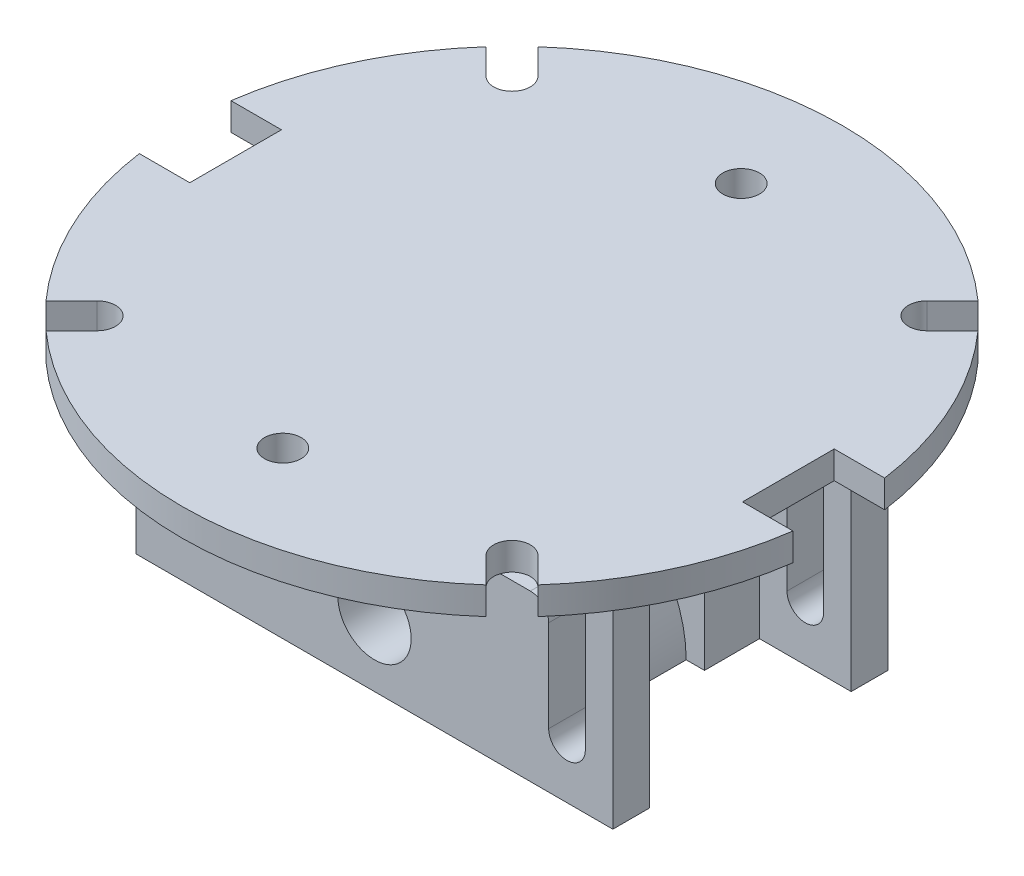
from build123d import *

# Parameters (mm, degrees)
EXTRUDE_1_DEPTH           = 12.5
CUT_EXTRUDE_1_DEPTH       = 20.532024985
CUT_EXTRUDE_1_DEPTH_BACK  = 20.532024985
SKETCH_2_R                = 2
CUT_EXTRUDE_2_DEPTH       = 20.532024985
CUT_EXTRUDE_2_DEPTH_BACK  = 20.532024985
CUT_EXTRUDE_START         = 12.5
SKETCH_5_W                = 16
SKETCH_5_H                = 5
CUT_EXTRUDE_4_DEPTH       = 5.5
CUT_EXTRUDE_5_DEPTH       = 2.5
CUT_EXTRUDE_5_DEPTH_BACK  = 2.5
EXTRUDE_START             = 12.5
EXTRUDE_5_DEPTH           = 1.5
SKETCH_8_R                = 1
CUT_EXTRUDE_6_DEPTH       = 1.5
CUT_EXTRUDE_START_2       = 14
CUT_EXTRUDE_7_DEPTH       = 1.5
CUT_EXTRUDE_9_DEPTH       = 29.943911277
CUT_EXTRUDE_9_DEPTH_BACK  = 29.943911277
CUT_EXTRUDE_10_DEPTH      = 29.943911277
CUT_EXTRUDE_10_DEPTH_BACK = 29.943911277


with BuildPart() as part:
    # 草图1 → 凸台-拉伸1 (new body)
    with BuildSketch(Plane(origin=(0, 0, 0), x_dir=(1, 0, 0), z_dir=(0, 1, 0))):
        Polygon((13, 5.5), (8, 5.5), (8, -5.5), (13, -5.5), (13, -7.5), (-13, -7.5), (-13, -5.5), (-8, -5.5), (-8, 5.5), (-13, 5.5), (-13, 7.5), (13, 7.5), align=None)
    extrude(amount=EXTRUDE_1_DEPTH)

    # 草图2 → 切除-拉伸1 (cut, two sides: drawn at the far end of the back side and taken through both)
    with BuildSketch(Plane.XY.offset(-CUT_EXTRUDE_1_DEPTH_BACK)):
        with Locations((0, 3.5)):
            Circle(SKETCH_2_R)
    extrude(amount=CUT_EXTRUDE_1_DEPTH + CUT_EXTRUDE_1_DEPTH_BACK, mode=Mode.SUBTRACT)

    # 草图3 → 切除-拉伸2 (cut, two sides: drawn at the far end of the back side and taken through both)
    with BuildSketch(Plane.XY.offset(-CUT_EXTRUDE_2_DEPTH_BACK)):
        with BuildLine():
            Line((-10.5, 11), (-2, 11))
            ThreePointArc((-2, 11), (-1, 10), (-2, 9))
            Line((-2, 9), (-10.5, 9))
            ThreePointArc((-10.5, 9), (-11.5, 10), (-10.5, 11))
        make_face()
        with BuildLine():
            Line((2, 9), (10.5, 9))
            ThreePointArc((10.5, 9), (11.5, 10), (10.5, 11))
            Line((10.5, 11), (2, 11))
            ThreePointArc((2, 11), (1, 10), (2, 9))
        make_face()
    extrude(amount=CUT_EXTRUDE_2_DEPTH + CUT_EXTRUDE_2_DEPTH_BACK, mode=Mode.SUBTRACT)

    # 草图5 → 切除-拉伸4 (cut)
    with BuildSketch(Plane(origin=(0, 0, 0), x_dir=(1, 0, 0), z_dir=(0, 1, 0)).offset(CUT_EXTRUDE_START)):
        Rectangle(SKETCH_5_W, SKETCH_5_H)
    extrude(amount=-CUT_EXTRUDE_4_DEPTH, mode=Mode.SUBTRACT)

    # 草图6 → 切除-拉伸5 (cut, two sides: drawn at the far end of the back side and taken through both)
    with BuildSketch(Plane.XY.offset(-CUT_EXTRUDE_5_DEPTH_BACK)):
        with BuildLine():
            Line((8, 7), (0, 7))
            ThreePointArc((0, 7), (4.949747468, 4.949747468), (7, 0))
            Line((7, 0), (8, 0))
            Line((8, 0), (8, 7))
        make_face()
        with BuildLine():
            Line((-8, 7), (-8, 0))
            Line((-8, 0), (-7, 0))
            ThreePointArc((-7, 0), (-4.949747468, 4.949747468), (0, 7))
            Line((0, 7), (-8, 7))
        make_face()
    extrude(amount=CUT_EXTRUDE_5_DEPTH + CUT_EXTRUDE_5_DEPTH_BACK, mode=Mode.SUBTRACT)

    # 草图7 → 凸台-拉伸5 (add)
    with BuildSketch(Plane(origin=(0, 0, 0), x_dir=(1, 0, 0), z_dir=(0, 1, 0)).offset(EXTRUDE_START)):
        with BuildLine():
            Line((17.82554347, 2.5), (15.07554347, 2.5))
            Line((15.07554347, 2.5), (15.07554347, -2.5))
            Line((15.07554347, -2.5), (17.82554347, -2.5))
            ThreePointArc((17.82554347, -2.5), (0, -18), (-17.82554347, -2.5))
            Line((-17.82554347, -2.5), (-15.07554347, -2.5))
            Line((-15.07554347, -2.5), (-15.07554347, 2.5))
            Line((-15.07554347, 2.5), (-17.82554347, 2.5))
            ThreePointArc((-17.82554347, 2.5), (0, 18), (17.82554347, 2.5))
        make_face()
    extrude(amount=EXTRUDE_5_DEPTH)

    # 草图8 → 切除-拉伸6 (cut)
    with BuildSketch(Plane(origin=(0, 0, 0), x_dir=(1, 0, 0), z_dir=(0, 1, 0)).offset(CUT_EXTRUDE_START)):
        with Locations(Location((0, 12.5, 0), (0, 0, 270))):
            Circle(SKETCH_8_R)
        with Locations(Location((0, -12.5, 0), (0, 0, 270))):
            Circle(SKETCH_8_R)
    extrude(amount=CUT_EXTRUDE_6_DEPTH, mode=Mode.SUBTRACT)

    # 草图9 → 切除-拉伸7 (cut)
    with BuildSketch(Plane(origin=(0, 0, 0), x_dir=(1, 0, 0), z_dir=(0, 1, 0)).offset(CUT_EXTRUDE_START_2)):
        with BuildLine():
            Line((-12.02081528, 10.606601718), (-13.435028843, 12.02081528))
            ThreePointArc((-13.435028843, 12.02081528), (-13.435028843, 13.435028843), (-12.02081528, 13.435028843))
            Line((-12.02081528, 13.435028843), (-10.606601718, 12.02081528))
            ThreePointArc((-10.606601718, 12.02081528), (-10.606601718, 10.606601718), (-12.02081528, 10.606601718))
        make_face()
        with BuildLine():
            Line((10.606601718, -12.02081528), (12.02081528, -13.435028843))
            ThreePointArc((12.02081528, -13.435028843), (13.435028843, -13.435028843), (13.435028843, -12.02081528))
            Line((13.435028843, -12.02081528), (12.02081528, -10.606601718))
            ThreePointArc((12.02081528, -10.606601718), (10.606601718, -10.606601718), (10.606601718, -12.02081528))
        make_face()
        with BuildLine():
            Line((-12.02081528, -10.606601718), (-13.435028843, -12.02081528))
            ThreePointArc((-13.435028843, -12.02081528), (-13.435028843, -13.435028843), (-12.02081528, -13.435028843))
            Line((-12.02081528, -13.435028843), (-10.606601718, -12.02081528))
            ThreePointArc((-10.606601718, -12.02081528), (-10.606601718, -10.606601718), (-12.02081528, -10.606601718))
        make_face()
        with BuildLine():
            Line((10.606601718, 12.02081528), (12.02081528, 13.435028843))
            ThreePointArc((12.02081528, 13.435028843), (13.435028843, 13.435028843), (13.435028843, 12.02081528))
            Line((13.435028843, 12.02081528), (12.02081528, 10.606601718))
            ThreePointArc((12.02081528, 10.606601718), (10.606601718, 10.606601718), (10.606601718, 12.02081528))
        make_face()
    extrude(amount=-CUT_EXTRUDE_7_DEPTH, mode=Mode.SUBTRACT)

    # 草图10 → 切除-拉伸9 (cut, two sides: drawn at the far end of the back side and taken through both)
    with BuildSketch(Plane.XY.offset(-CUT_EXTRUDE_9_DEPTH_BACK)):
        with BuildLine():
            Line((-11.5, 10), (-11.5, 3))
            ThreePointArc((-11.5, 3), (-10.5, 2), (-9.5, 3))
            Line((-9.5, 3), (-9.5, 10))
            ThreePointArc((-9.5, 10), (-10.5, 11), (-11.5, 10))
        make_face()
        with BuildLine():
            Line((11.5, 10), (11.5, 3))
            ThreePointArc((11.5, 3), (10.5, 2), (9.5, 3))
            Line((9.5, 3), (9.5, 10))
            ThreePointArc((9.5, 10), (10.5, 11), (11.5, 10))
        make_face()
    extrude(amount=CUT_EXTRUDE_9_DEPTH + CUT_EXTRUDE_9_DEPTH_BACK, mode=Mode.SUBTRACT)

    # 草图11 → 切除-拉伸10 (cut, two sides: drawn at the far end of the back side and taken through both)
    with BuildSketch(Plane.XY.offset(-CUT_EXTRUDE_10_DEPTH_BACK)):
        with BuildLine():
            Line((8.5, 9), (9.5, 9))
            Line((9.5, 9), (9.5, 8))
            ThreePointArc((9.5, 8), (9.207106781, 8.707106781), (8.5, 9))
        make_face()
        with BuildLine():
            Line((-9.5, 9), (-9.5, 8))
            ThreePointArc((-9.5, 8), (-9.207106781, 8.707106781), (-8.5, 9))
            Line((-8.5, 9), (-9.5, 9))
        make_face()
    extrude(amount=CUT_EXTRUDE_10_DEPTH + CUT_EXTRUDE_10_DEPTH_BACK, mode=Mode.SUBTRACT)


solid = part.part
